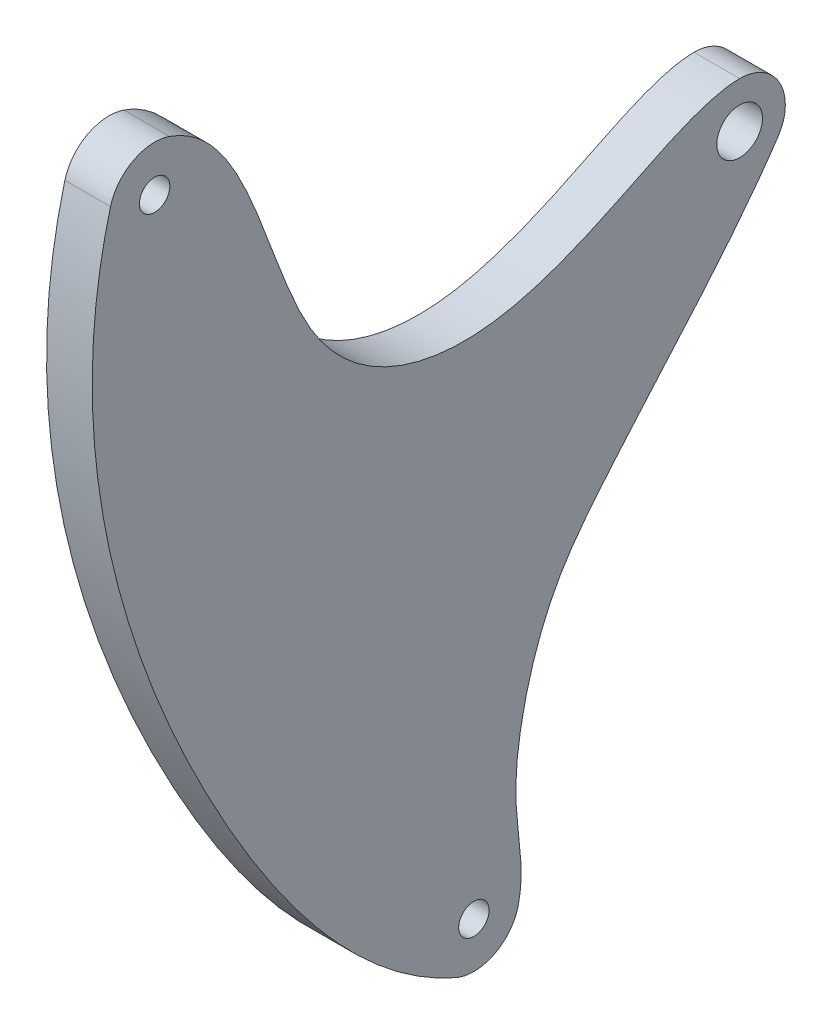
from build123d import *

# Parameters (mm, degrees)
SKETCH3_R               = 1
SKETCH3_R_2             = 1.375
BOSS_EXTRUDE4_DEPTH     = 3
SCALE1_SCALE            = 2
SKETCH4_R               = 3
CUT_EXTRUDE1_DEPTH      = 217.492464221
CUT_EXTRUDE2_DEPTH      = 217.492464221
CUT_EXTRUDE2_DEPTH_BACK = 217.492464221
SKETCH5_OUTSIDE_W       = 182.432
SKETCH5_OUTSIDE_H       = 155.93


with BuildPart() as part:
    # Sketch3 → Boss-Extrude4 (new body)
    with BuildSketch(Plane.YZ):
        with BuildLine():
            ThreePointArc((68.741192765, 86.464667173), (54.029322851, 96.141629316), (37.312023136, 101.674675757))
            ThreePointArc((37.312023136, 101.674675757), (29.391760942, 109.480441545), (33.583388697, 119.780479872))
            ThreePointArc((33.583388697, 119.780479872), (60.17601512, 133.969459732), (89.135388402, 142.32706876))
            ThreePointArc((89.135388402, 142.32706876), (99.144821049, 138.126502646), (99.427319768, 127.275065319))
            ThreePointArc((99.427319768, 127.275065319), (90.789860229, 110.128583952), (85.032843595, 91.812899689))
            ThreePointArc((85.032843595, 91.812899689), (78.400596073, 84.528160677), (68.741192765, 86.464667173))
        make_face()
        with Locations(Location((39.186227842, 111.497473562, 0), (0, 0, 270))):
            Circle(SKETCH3_R, mode=Mode.SUBTRACT)
        with Locations(Location((90.890008855, 132.482206797, 0), (0, 0, 270))):
            Circle(SKETCH3_R, mode=Mode.SUBTRACT)
        with Locations(Location((75.281557454, 94.029297351, 0), (0, 0, 270))):
            Circle(SKETCH3_R_2, mode=Mode.SUBTRACT)
    extrude(amount=BOSS_EXTRUDE4_DEPTH)


with BuildPart() as part_1:
    # Scale1: scaled about (1.5, 67.877354977, 114.955402134)
    add(part.part.scale(SCALE1_SCALE).moved(Location((-1.5, -67.877354977, -114.955402134))))

    # Sketch4 → Cut-Extrude1 (cut, through all)
    with BuildSketch(Plane.YZ.offset(4.5)):
        with Locations(Location((82.685759932, 73.103192567, 0), (0, 0, 270))):
            Circle(SKETCH4_R)
    extrude(amount=-CUT_EXTRUDE1_DEPTH, mode=Mode.SUBTRACT)

    # Sketch5 outside → Cut-Extrude2 (cut, two sides: drawn at the far end of the back side and taken through both)
    with BuildSketch(Plane.YZ.offset(4.5).offset(-CUT_EXTRUDE2_DEPTH_BACK)):
        with Locations((62.199, 111.556)):
            Rectangle(SKETCH5_OUTSIDE_W, SKETCH5_OUTSIDE_H)
        with BuildLine():
            ThreePointArc((119.569371521, 148.037105906), (119.203645824, 152.8196303), (115.450254013, 155.805990089))
            add(Edge.make_bspline(
                [(115.450254013, 155.805990089), (92.291332554, 161.988615073), (50.144999616, 152.195780174), (10.640315527, 123.38981482), (4.994818673, 110.43681376)],
                knots=[0.017811673, 0.017811673, 0.017811673, 0.017811673, 0.625020949, 0.983264819, 0.983264819, 0.983264819, 0.983264819], degree=3))
            ThreePointArc((4.994818673, 110.43681376), (5.130906228, 105.351531301), (9.123047592, 102.19852879))
            add(Edge.make_bspline(
                [(9.123047592, 102.19852879), (12.874033904, 101.317423127), (20.330488059, 103.128054064), (32.415267004, 101.651722539), (43.037738842, 97.936984862), (58.438217116, 85.786415304), (69.386713525, 74.853454362), (80.449954201, 67.434576825), (81.492677056, 67.22300947)],
                knots=[0, 0, 0, 0, 0.139372949, 0.261466364, 0.436165055, 0.534003981, 0.961982331, 1, 1, 1, 1], degree=3))
            ThreePointArc((81.492677056, 67.22300947), (86.483226373, 68.457845581), (88.685759932, 73.103192567))
            add(Edge.make_bspline(
                [(119.569371521, 148.037105906), (115.777884331, 137.141424956), (83.707026682, 134.20773874), (74.375699666, 110.415829432), (80.752950982, 92.088648695), (88.685759932, 77.778956378), (88.685759932, 73.103192567)],
                knots=[0.022808472, 0.022808472, 0.022808472, 0.022808472, 0.37815179, 0.637109171, 0.823995801, 0.964332075, 0.964332075, 0.964332075, 0.964332075], degree=3))
        make_face(mode=Mode.SUBTRACT)
    extrude(amount=CUT_EXTRUDE2_DEPTH + CUT_EXTRUDE2_DEPTH_BACK, mode=Mode.SUBTRACT)


solid = part_1.part
